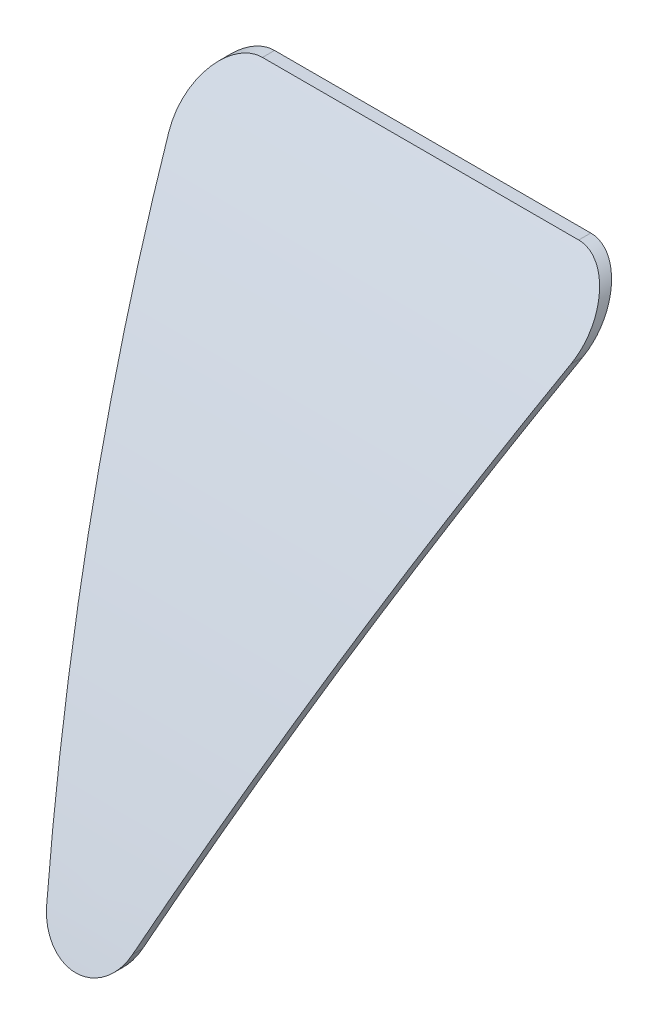
from build123d import *

# Parameters (mm, degrees)
BOSS_EXTRUDE1_DEPTH      = 60
BOSS_EXTRUDE1_DEPTH_BACK = 60
SKETCH2_W                = 211.885293394
SKETCH2_H                = 245.618275427
CUT_EXTRUDE1_DEPTH       = 1077.011666391


with BuildPart() as part:
    # Sketch1 → Boss-Extrude1 (new, two sides: drawn at the far end of the back side and taken through both)
    with BuildSketch(Plane(origin=(0, 0, 0), x_dir=(0, 0, -1), z_dir=(1, 0, 0)).offset(-BOSS_EXTRUDE1_DEPTH_BACK)):
        with BuildLine():
            Line((-939.728923081, 10.577778274), (-941.143184766, 11.992039959))
            add(Edge.make_bspline(
                [(-941.143184766, 11.992039959), (-944.866454136, 8.352727843), (-953.96735323, -0.88168341), (-973.200532651, -22.236280395), (-997.43063536, -53.698126084), (-1022.870084933, -94.455289348), (-1043.814229453, -136.740255628), (-1054.637723921, -165.536150075), (-1059.122238281, -179.688951706)],
                knots=[0.580973428, 0.580973428, 0.580973428, 0.580973428, 0.601711861, 0.63234941, 0.693624509, 0.754899607, 0.816174705, 0.874857615, 0.874857615, 0.874857615, 0.874857615], degree=3))
            Line((-1059.122238281, -179.688951706), (-1057.176612318, -180.169892955))
            add(Edge.make_bspline(
                [(-939.728923081, 10.577778274), (-992.215291969, -40.719110356), (-1034.812797305, -109.667140015), (-1057.176612318, -180.169892955)],
                knots=[0.580942389, 0.580942389, 0.580942389, 0.580942389, 0.874686569, 0.874686569, 0.874686569, 0.874686569], degree=3))
        make_face()
    extrude(amount=BOSS_EXTRUDE1_DEPTH + BOSS_EXTRUDE1_DEPTH_BACK)

    # Sketch2 → Cut-Extrude1 (cut, through all)
    with BuildSketch(Plane.XY):
        with Locations((18.076578956, -88.621698106)):
            Rectangle(SKETCH2_W, SKETCH2_H)
        with BuildLine():
            Line((-0.946549017, -13.77664422), (0.946549017, -13.77664422))
            Line((0.946549017, -13.77664422), (34.752164535, -13.77664422))
            ThreePointArc((34.752164535, -13.77664422), (42.910959356, -17.994424311), (44.187353703, -27.089830806))
            Line((44.187353703, -27.089830806), (9.435189169, -126.055958395))
            ThreePointArc((9.435189169, -126.055958395), (0, -132.742771809), (-9.435189169, -126.055958395))
            Line((-9.435189169, -126.055958395), (-44.187353703, -27.089830806))
            ThreePointArc((-44.187353703, -27.089830806), (-42.910959356, -17.994424311), (-34.752164535, -13.77664422))
            Line((-34.752164535, -13.77664422), (-0.946549017, -13.77664422))
        make_face(mode=Mode.SUBTRACT)
    extrude(amount=CUT_EXTRUDE1_DEPTH, mode=Mode.SUBTRACT)


solid = part.part
